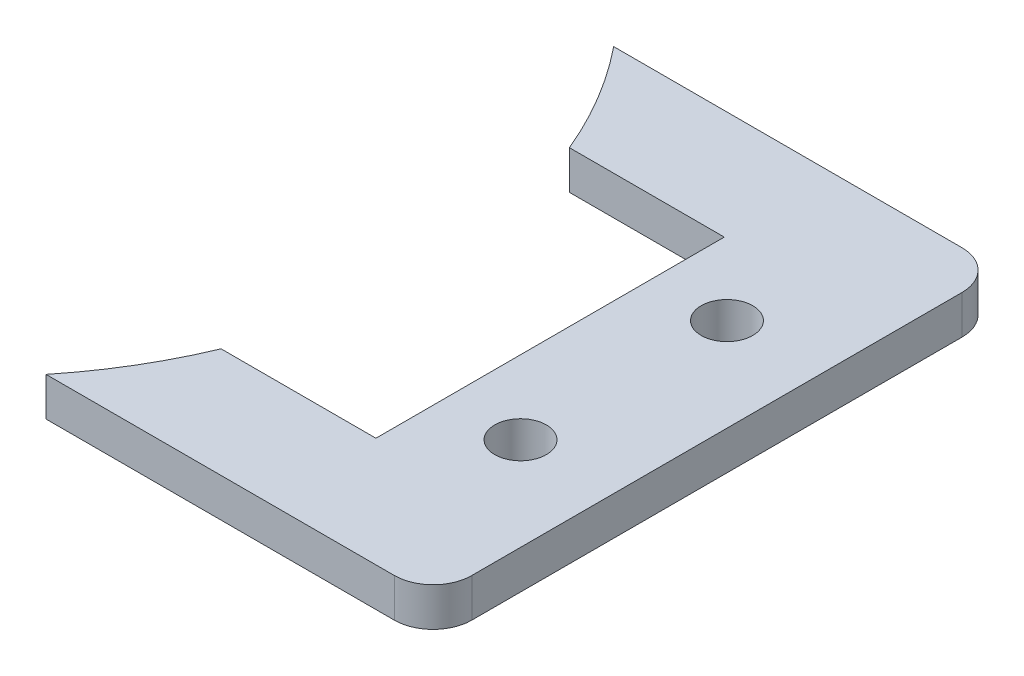
from build123d import *

# Parameters (mm, degrees)
SKETCH_1_R      = 2
EXTRUDE_1_DEPTH = 3
FILLET_1_R      = 3


with BuildPart() as part:
    # 草图1 → 凸台-拉伸1 (new body)
    with BuildSketch(Plane(origin=(0, 0, 0), x_dir=(1, 0, 0), z_dir=(0, 1, 0))):
        with BuildLine():
            Line((57.221315178, 22), (27.221315178, 22))
            ThreePointArc((27.221315178, 22), (30.058450594, 17.930129612), (32.291639785, 13.5))
            Line((32.291639785, 13.5), (44.291639785, 13.5))
            Line((44.291639785, 13.5), (44.291639785, -13.5))
            Line((44.291639785, -13.5), (32.291639785, -13.5))
            ThreePointArc((32.291639785, -13.5), (30.058450594, -17.930129612), (27.221315178, -22))
            Line((27.221315178, -22), (57.221315178, -22))
            Line((57.221315178, -22), (57.221315178, 22))
        make_face()
        with Locations(Location((50, -8, 0), (0, 0, 270))):
            Circle(SKETCH_1_R, mode=Mode.SUBTRACT)
        with Locations(Location((50, 8, 0), (0, 0, 270))):
            Circle(SKETCH_1_R, mode=Mode.SUBTRACT)
    extrude(amount=EXTRUDE_1_DEPTH)

    # 圆角1
    fillet_1_edges = [part.edges().sort_by_distance(p)[0] for p in [
        (57.221315178, 1.5, -22),
        (57.221315178, 1.5, 22),
    ]]
    fillet(fillet_1_edges, radius=FILLET_1_R)


solid = part.part
